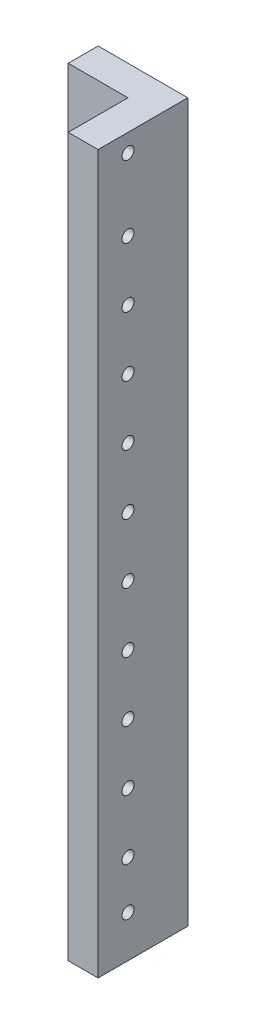
from build123d import *

# Parameters (mm, degrees)
BOSS_EXTRUDE1_DEPTH = 120
SKETCH2_R           = 1
CUT_EXTRUDE3_DEPTH  = 120
SKETCH4_R           = 1
CUT_EXTRUDE4_DEPTH  = 120
SKETCH5_R           = 1
CUT_EXTRUDE5_DEPTH  = 120
SKETCH6_R           = 1
CUT_EXTRUDE6_DEPTH  = 120
SKETCH8_R           = 1
CUT_EXTRUDE7_DEPTH  = 120
SKETCH9_R           = 1
CUT_EXTRUDE8_DEPTH  = 120


with BuildPart() as part:
    # Sketch1 → Boss-Extrude1 (new body)
    with BuildSketch(Plane(origin=(0, 0, 0), x_dir=(1, 0, 0), z_dir=(0, 1, 0))):
        Polygon((-19.661478752, 6.607142857), (-4.661478752, 6.607142857), (-4.661478752, -8.392857143), (-9.661478752, -8.392857143), (-9.661478752, 1.607142857), (-19.661478752, 1.607142857), align=None)
    extrude(amount=BOSS_EXTRUDE1_DEPTH)

    # Sketch2 → Cut-Extrude3 (cut)
    with BuildSketch(Plane(origin=(-4.661478752, 0, 0), x_dir=(0, 0, -1), z_dir=(1, 0, 0))):
        with Locations((-3.392857143, 117)):
            Circle(SKETCH2_R)
    extrude(amount=-CUT_EXTRUDE3_DEPTH, mode=Mode.SUBTRACT)

    # Sketch4 → Cut-Extrude4 (cut)
    with BuildSketch(Plane(origin=(0, 0, -6.607142857), x_dir=(-1, 0, 0), z_dir=(0, 0, -1))):
        with Locations((14.661478752, 113)):
            Circle(SKETCH4_R)
    extrude(amount=-CUT_EXTRUDE4_DEPTH, mode=Mode.SUBTRACT)

    # Sketch5 → Cut-Extrude5 (cut)
    with BuildSketch(Plane(origin=(-4.661478752, 0, 0), x_dir=(0, 0, -1), z_dir=(1, 0, 0))):
        with Locations((-3.392857143, 7)):
            Circle(SKETCH5_R)
    extrude(amount=-CUT_EXTRUDE5_DEPTH, mode=Mode.SUBTRACT)

    # Sketch6 → Cut-Extrude6 (cut)
    with BuildSketch(Plane(origin=(0, 0, -6.607142857), x_dir=(-1, 0, 0), z_dir=(0, 0, -1))):
        with Locations((14.661478752, 3)):
            Circle(SKETCH6_R)
    extrude(amount=-CUT_EXTRUDE6_DEPTH, mode=Mode.SUBTRACT)

    # Sketch8 → Cut-Extrude7 (cut)
    with BuildSketch(Plane(origin=(-4.661478752, 0, 0), x_dir=(0, 0, -1), z_dir=(1, 0, 0))):
        with Locations((-3.392857143, 105)):
            Circle(SKETCH8_R)
        with Locations((-3.392857143, 95)):
            Circle(SKETCH8_R)
        with Locations((-3.392857143, 85)):
            Circle(SKETCH8_R)
        with Locations((-3.392857143, 75)):
            Circle(SKETCH8_R)
        with Locations((-3.392857143, 65)):
            Circle(SKETCH8_R)
        with Locations((-3.392857143, 55)):
            Circle(SKETCH8_R)
        with Locations((-3.392857143, 45)):
            Circle(SKETCH8_R)
        with Locations((-3.392857143, 35)):
            Circle(SKETCH8_R)
        with Locations((-3.392857143, 25)):
            Circle(SKETCH8_R)
        with Locations((-3.392857143, 15)):
            Circle(SKETCH8_R)
    extrude(amount=-CUT_EXTRUDE7_DEPTH, mode=Mode.SUBTRACT)

    # Sketch9 → Cut-Extrude8 (cut)
    with BuildSketch(Plane(origin=(0, 0, -6.607142857), x_dir=(-1, 0, 0), z_dir=(0, 0, -1))):
        with Locations((14.661478752, 15)):
            Circle(SKETCH9_R)
        with Locations((14.661478752, 25)):
            Circle(SKETCH9_R)
        with Locations((14.661478752, 35)):
            Circle(SKETCH9_R)
        with Locations((14.661478752, 45)):
            Circle(SKETCH9_R)
        with Locations((14.661478752, 55)):
            Circle(SKETCH9_R)
        with Locations((14.661478752, 65)):
            Circle(SKETCH9_R)
        with Locations((14.661478752, 75)):
            Circle(SKETCH9_R)
        with Locations((14.661478752, 85)):
            Circle(SKETCH9_R)
        with Locations((14.661478752, 95)):
            Circle(SKETCH9_R)
        with Locations((14.661478752, 105)):
            Circle(SKETCH9_R)
    extrude(amount=-CUT_EXTRUDE8_DEPTH, mode=Mode.SUBTRACT)


solid = part.part
